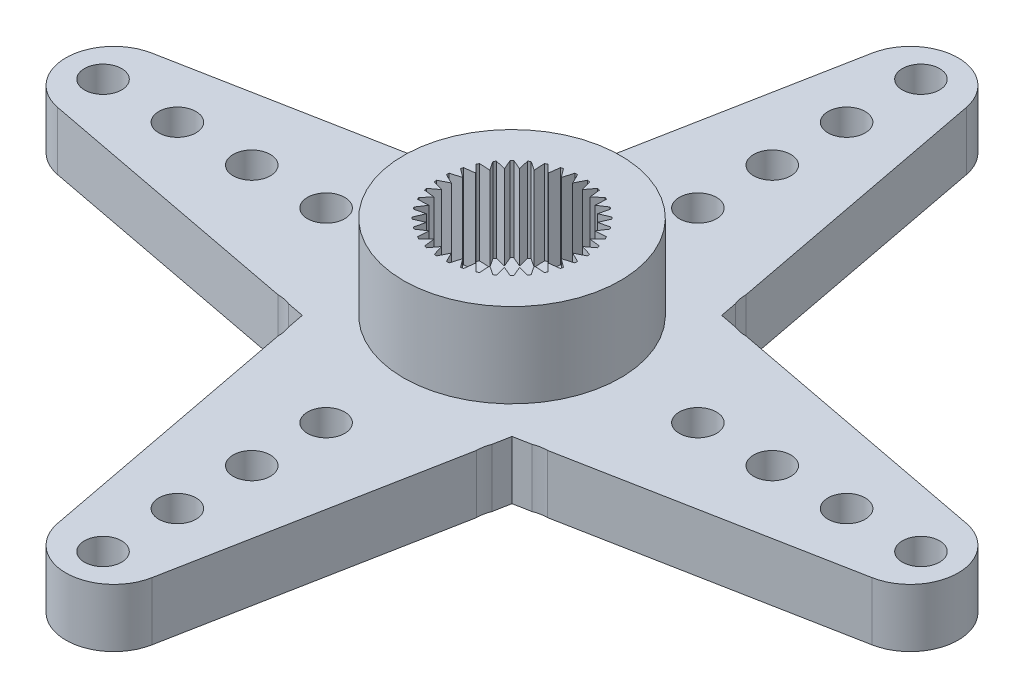
from build123d import *

# Parameters (mm, degrees)
BOSS_EXTRUDE1_DEPTH                                 = 2.35
CUT_EXTRUDE1_DEPTH                                  = 2.35
CUT_EXTRUDE2_DEPTH                                  = 2.35
CUT_EXTRUDE3_DEPTH                                  = 2.35
CUT_EXTRUDE4_DEPTH                                  = 2.35
CUT_EXTRUDE5_DEPTH                                  = 2.35
CUT_EXTRUDE6_DEPTH                                  = 2.35
CUT_EXTRUDE7_DEPTH                                  = 2.35
CUT_EXTRUDE8_DEPTH                                  = 2.35
SKETCH10_R                                          = 4.375
BOSS_EXTRUDE2_DEPTH                                 = 3.4
CUT_EXTRUDE9_DEPTH                                  = 3.4
HOLE1_D                                             = 8.8
HOLE1_DEPTH                                         = 0.3
SKETCH14_W                                          = 3.25
SKETCH14_H                                          = 0.3
F_00_CLEARANCE_HOLE1_D                              = 1.5
CBORE_FOR_3_BINDING_HEAD_MACHINE_SCREW1_D           = 3
CBORE_FOR_3_BINDING_HEAD_MACHINE_SCREW1_DEPTH       = 5.75
CBORE_FOR_3_BINDING_HEAD_MACHINE_SCREW1_CBORE_D     = 5.5
CBORE_FOR_3_BINDING_HEAD_MACHINE_SCREW1_CBORE_DEPTH = 0.3


with BuildPart() as part:
    # Sketch1 → Boss-Extrude1 (new body)
    with BuildSketch(Plane(origin=(0, 2.35, 0), x_dir=(1, 0, 0), z_dir=(0, 1, 0))):
        with BuildLine():
            Line((-16.428641042, -1.9), (-4.230530925, -4.230530925))
            Line((-4.230530925, -4.230530925), (-1.9, -16.428641042))
            ThreePointArc((-1.9, -16.428641042), (0, -18), (1.9, -16.428641042))
            Line((1.9, -16.428641042), (4.230530925, -4.230530925))
            Line((4.230530925, -4.230530925), (16.428641042, -1.9))
            ThreePointArc((16.428641042, -1.9), (18, 0), (16.428641042, 1.9))
            Line((16.428641042, 1.9), (4.230530925, 4.230530925))
            Line((4.230530925, 4.230530925), (1.9, 16.428641042))
            ThreePointArc((1.9, 16.428641042), (0, 18), (-1.9, 16.428641042))
            Line((-1.9, 16.428641042), (-4.230530925, 4.230530925))
            Line((-4.230530925, 4.230530925), (-16.428641042, 1.9))
            ThreePointArc((-16.428641042, 1.9), (-18, 0), (-16.428641042, -1.9))
        make_face()
    extrude(amount=-BOSS_EXTRUDE1_DEPTH)

    # Sketch2 → Cut-Extrude1 (cut)
    with BuildSketch(Plane.XZ):
        with BuildLine():
            Line((4.101224008, 4.907329504), (4, 5.437140793))
            ThreePointArc((4, 5.437140793), (4.025532815, 5.167443601), (4.101224008, 4.907329504))
        make_face()
    extrude(amount=-CUT_EXTRUDE1_DEPTH, mode=Mode.SUBTRACT)

    # Sketch3 → Cut-Extrude2 (cut)
    with BuildSketch(Plane.XZ):
        with BuildLine():
            Line((5.437140793, 4), (4.907329504, 4.101224008))
            ThreePointArc((4.907329504, 4.101224008), (5.167443601, 4.025532815), (5.437140793, 4))
        make_face()
    extrude(amount=-CUT_EXTRUDE2_DEPTH, mode=Mode.SUBTRACT)

    # Sketch4 → Cut-Extrude3 (cut)
    with BuildSketch(Plane.XZ):
        with BuildLine():
            Line((4.907329504, -4.101224008), (5.437140793, -4))
            ThreePointArc((5.437140793, -4), (5.167443601, -4.025532815), (4.907329504, -4.101224008))
        make_face()
    extrude(amount=-CUT_EXTRUDE3_DEPTH, mode=Mode.SUBTRACT)

    # Sketch5 → Cut-Extrude4 (cut)
    with BuildSketch(Plane.XZ):
        with BuildLine():
            Line((4, -5.437140793), (4.101224008, -4.907329504))
            ThreePointArc((4.101224008, -4.907329504), (4.025532815, -5.167443601), (4, -5.437140793))
        make_face()
    extrude(amount=-CUT_EXTRUDE4_DEPTH, mode=Mode.SUBTRACT)

    # Sketch6 → Cut-Extrude5 (cut)
    with BuildSketch(Plane.XZ):
        with BuildLine():
            Line((-4.101224008, -4.907329504), (-4, -5.437140793))
            ThreePointArc((-4, -5.437140793), (-4.025532815, -5.167443601), (-4.101224008, -4.907329504))
        make_face()
    extrude(amount=-CUT_EXTRUDE5_DEPTH, mode=Mode.SUBTRACT)

    # Sketch7 → Cut-Extrude6 (cut)
    with BuildSketch(Plane.XZ):
        with BuildLine():
            Line((-5.437140793, -4), (-4.907329504, -4.101224008))
            ThreePointArc((-4.907329504, -4.101224008), (-5.167443601, -4.025532815), (-5.437140793, -4))
        make_face()
    extrude(amount=-CUT_EXTRUDE6_DEPTH, mode=Mode.SUBTRACT)

    # Sketch8 → Cut-Extrude7 (cut)
    with BuildSketch(Plane.XZ):
        with BuildLine():
            Line((-4.907329504, 4.101224008), (-5.437140793, 4))
            ThreePointArc((-5.437140793, 4), (-5.167443601, 4.025532815), (-4.907329504, 4.101224008))
        make_face()
    extrude(amount=-CUT_EXTRUDE7_DEPTH, mode=Mode.SUBTRACT)

    # Sketch9 → Cut-Extrude8 (cut)
    with BuildSketch(Plane.XZ):
        with BuildLine():
            Line((-4, 5.437140793), (-4.101224008, 4.907329504))
            ThreePointArc((-4.101224008, 4.907329504), (-4.025532815, 5.167443601), (-4, 5.437140793))
        make_face()
    extrude(amount=-CUT_EXTRUDE8_DEPTH, mode=Mode.SUBTRACT)

    # Sketch10 → Boss-Extrude2 (add)
    with BuildSketch(Plane(origin=(0, 2.35, 0), x_dir=(-1, 0, 0), z_dir=(0, 1, 0))):
        with Locations(Location((0, 0, 0), (0, 0, 90))):
            Circle(SKETCH10_R)
    extrude(amount=BOSS_EXTRUDE2_DEPTH)

    # Sketch11 → Cut-Extrude9 (cut)
    with BuildSketch(Plane(origin=(0, 5.75, 0), x_dir=(-1, 0, 0), z_dir=(0, 1, 0))):
        with BuildLine():
            Line((0.687336745, 2.765875666), (0.425438035, 2.412778995))
            Line((0.425438035, 2.412778995), (0.300099924, 2.834155965))
            ThreePointArc((0.300099924, 2.834155965), (0.248393867, 2.83915489), (0.196605286, 2.843210573))
            Line((0.196605286, 2.843210573), (0, 2.45))
            Line((0, 2.45), (-0.196605286, 2.843210573))
            ThreePointArc((-0.196605286, 2.843210573), (-0.248393867, 2.83915489), (-0.300099924, 2.834155965))
            Line((-0.300099924, 2.834155965), (-0.425438035, 2.412778995))
            Line((-0.425438035, 2.412778995), (-0.687336745, 2.765875666))
            ThreePointArc((-0.687336745, 2.765875666), (-0.737634279, 2.752888605), (-0.787686751, 2.738986963))
            Line((-0.787686751, 2.738986963), (-0.837949351, 2.302246921))
            Line((-0.837949351, 2.302246921), (-1.157183824, 2.604501026))
            ThreePointArc((-1.157183824, 2.604501026), (-1.204462046, 2.582977193), (-1.251340114, 2.560595228))
            Line((-1.251340114, 2.560595228), (-1.225, 2.121762239))
            Line((-1.225, 2.121762239), (-1.591870459, 2.363989941))
            ThreePointArc((-1.591870459, 2.363989941), (-1.634692844, 2.334583326), (-1.676972141, 2.304401102))
            Line((-1.676972141, 2.304401102), (-1.574829644, 1.876808886))
            Line((-1.574829644, 1.876808886), (-1.978188915, 2.051650218))
            ThreePointArc((-1.978188915, 2.051650218), (-2.015254326, 2.015254326), (-2.051650218, 1.978188915))
            Line((-2.051650218, 1.978188915), (-1.876808886, 1.574829644))
            Line((-1.876808886, 1.574829644), (-2.304401102, 1.676972141))
            ThreePointArc((-2.304401102, 1.676972141), (-2.334583326, 1.634692844), (-2.363989941, 1.591870459))
            Line((-2.363989941, 1.591870459), (-2.121762239, 1.225))
            Line((-2.121762239, 1.225), (-2.560595228, 1.251340114))
            ThreePointArc((-2.560595228, 1.251340114), (-2.582977193, 1.204462046), (-2.604501026, 1.157183824))
            Line((-2.604501026, 1.157183824), (-2.302246921, 0.837949351))
            Line((-2.302246921, 0.837949351), (-2.738986963, 0.787686751))
            ThreePointArc((-2.738986963, 0.787686751), (-2.752888605, 0.737634279), (-2.765875666, 0.687336745))
            Line((-2.765875666, 0.687336745), (-2.412778995, 0.425438035))
            Line((-2.412778995, 0.425438035), (-2.834155965, 0.300099924))
            ThreePointArc((-2.834155965, 0.300099924), (-2.83915489, 0.248393867), (-2.843210573, 0.196605286))
            Line((-2.843210573, 0.196605286), (-2.45, 0))
            Line((-2.45, 0), (-2.843210573, -0.196605286))
            ThreePointArc((-2.843210573, -0.196605286), (-2.83915489, -0.248393867), (-2.834155965, -0.300099924))
            Line((-2.834155965, -0.300099924), (-2.412778995, -0.425438035))
            Line((-2.412778995, -0.425438035), (-2.765875666, -0.687336745))
            ThreePointArc((-2.765875666, -0.687336745), (-2.752888605, -0.737634279), (-2.738986963, -0.787686751))
            Line((-2.738986963, -0.787686751), (-2.302246921, -0.837949351))
            Line((-2.302246921, -0.837949351), (-2.604501026, -1.157183824))
            ThreePointArc((-2.604501026, -1.157183824), (-2.582977193, -1.204462046), (-2.560595228, -1.251340114))
            Line((-2.560595228, -1.251340114), (-2.121762239, -1.225))
            Line((-2.121762239, -1.225), (-2.363989941, -1.591870459))
            ThreePointArc((-2.363989941, -1.591870459), (-2.334583326, -1.634692844), (-2.304401102, -1.676972141))
            Line((-2.304401102, -1.676972141), (-1.876808886, -1.574829644))
            Line((-1.876808886, -1.574829644), (-2.051650218, -1.978188915))
            ThreePointArc((-2.051650218, -1.978188915), (-2.015254326, -2.015254326), (-1.978188915, -2.051650218))
            Line((-1.978188915, -2.051650218), (-1.574829644, -1.876808886))
            Line((-1.574829644, -1.876808886), (-1.676972141, -2.304401102))
            ThreePointArc((-1.676972141, -2.304401102), (-1.634692844, -2.334583326), (-1.591870459, -2.363989941))
            Line((-1.591870459, -2.363989941), (-1.225, -2.121762239))
            Line((-1.225, -2.121762239), (-1.251340114, -2.560595228))
            ThreePointArc((-1.251340114, -2.560595228), (-1.204462046, -2.582977193), (-1.157183824, -2.604501026))
            Line((-1.157183824, -2.604501026), (-0.837949351, -2.302246921))
            Line((-0.837949351, -2.302246921), (-0.787686751, -2.738986963))
            ThreePointArc((-0.787686751, -2.738986963), (-0.737634279, -2.752888605), (-0.687336745, -2.765875666))
            Line((-0.687336745, -2.765875666), (-0.425438035, -2.412778995))
            Line((-0.425438035, -2.412778995), (-0.300099924, -2.834155965))
            ThreePointArc((-0.300099924, -2.834155965), (-0.248393867, -2.83915489), (-0.196605286, -2.843210573))
            Line((-0.196605286, -2.843210573), (0, -2.45))
            Line((0, -2.45), (0.196605286, -2.843210573))
            ThreePointArc((0.196605286, -2.843210573), (0.248393867, -2.83915489), (0.300099924, -2.834155965))
            Line((0.300099924, -2.834155965), (0.425438035, -2.412778995))
            Line((0.425438035, -2.412778995), (0.687336745, -2.765875666))
            ThreePointArc((0.687336745, -2.765875666), (0.737634279, -2.752888605), (0.787686751, -2.738986963))
            Line((0.787686751, -2.738986963), (0.837949351, -2.302246921))
            Line((0.837949351, -2.302246921), (1.157183824, -2.604501026))
            ThreePointArc((1.157183824, -2.604501026), (1.204462046, -2.582977193), (1.251340114, -2.560595228))
            Line((1.251340114, -2.560595228), (1.225, -2.121762239))
            Line((1.225, -2.121762239), (1.591870459, -2.363989941))
            ThreePointArc((1.591870459, -2.363989941), (1.634692844, -2.334583326), (1.676972141, -2.304401102))
            Line((1.676972141, -2.304401102), (1.574829644, -1.876808886))
            Line((1.574829644, -1.876808886), (1.978188915, -2.051650218))
            ThreePointArc((1.978188915, -2.051650218), (2.015254326, -2.015254326), (2.051650218, -1.978188915))
            Line((2.051650218, -1.978188915), (1.876808886, -1.574829644))
            Line((1.876808886, -1.574829644), (2.304401102, -1.676972141))
            ThreePointArc((2.304401102, -1.676972141), (2.334583326, -1.634692844), (2.363989941, -1.591870459))
            Line((2.363989941, -1.591870459), (2.121762239, -1.225))
            Line((2.121762239, -1.225), (2.560595228, -1.251340114))
            ThreePointArc((2.560595228, -1.251340114), (2.582977193, -1.204462046), (2.604501026, -1.157183824))
            Line((2.604501026, -1.157183824), (2.302246921, -0.837949351))
            Line((2.302246921, -0.837949351), (2.738986963, -0.787686751))
            ThreePointArc((2.738986963, -0.787686751), (2.752888605, -0.737634279), (2.765875666, -0.687336745))
            Line((2.765875666, -0.687336745), (2.412778995, -0.425438035))
            Line((2.412778995, -0.425438035), (2.834155965, -0.300099924))
            ThreePointArc((2.834155965, -0.300099924), (2.83915489, -0.248393867), (2.843210573, -0.196605286))
            Line((2.843210573, -0.196605286), (2.45, 0))
            Line((2.45, 0), (2.843210573, 0.196605286))
            ThreePointArc((2.843210573, 0.196605286), (2.83915489, 0.248393867), (2.834155965, 0.300099924))
            Line((2.834155965, 0.300099924), (2.412778995, 0.425438035))
            Line((2.412778995, 0.425438035), (2.765875666, 0.687336745))
            ThreePointArc((2.765875666, 0.687336745), (2.752888605, 0.737634279), (2.738986963, 0.787686751))
            Line((2.738986963, 0.787686751), (2.302246921, 0.837949351))
            Line((2.302246921, 0.837949351), (2.604501026, 1.157183824))
            ThreePointArc((2.604501026, 1.157183824), (2.582977193, 1.204462046), (2.560595228, 1.251340114))
            Line((2.560595228, 1.251340114), (2.121762239, 1.225))
            Line((2.121762239, 1.225), (2.363989941, 1.591870459))
            ThreePointArc((2.363989941, 1.591870459), (2.334583326, 1.634692844), (2.304401102, 1.676972141))
            Line((2.304401102, 1.676972141), (1.876808886, 1.574829644))
            Line((1.876808886, 1.574829644), (2.051650218, 1.978188915))
            ThreePointArc((2.051650218, 1.978188915), (2.015254326, 2.015254326), (1.978188915, 2.051650218))
            Line((1.978188915, 2.051650218), (1.574829644, 1.876808886))
            Line((1.574829644, 1.876808886), (1.676972141, 2.304401102))
            ThreePointArc((1.676972141, 2.304401102), (1.634692844, 2.334583326), (1.591870459, 2.363989941))
            Line((1.591870459, 2.363989941), (1.225, 2.121762239))
            Line((1.225, 2.121762239), (1.251340114, 2.560595228))
            ThreePointArc((1.251340114, 2.560595228), (1.204462046, 2.582977193), (1.157183824, 2.604501026))
            Line((1.157183824, 2.604501026), (0.837949351, 2.302246921))
            Line((0.837949351, 2.302246921), (0.787686751, 2.738986963))
            ThreePointArc((0.787686751, 2.738986963), (0.737634279, 2.752888605), (0.687336745, 2.765875666))
        make_face()
    extrude(amount=-CUT_EXTRUDE9_DEPTH, mode=Mode.SUBTRACT)

    # Hole1
    with Locations(Plane(origin=(0, 0, 0), x_dir=(-1, 0, 0), z_dir=(0, -1, 0))):
        with Locations((0, 0)):
            Hole(HOLE1_D / 2, depth=HOLE1_DEPTH)

    # Sketch14 → Revolve1 (revolve)
    with BuildSketch(Plane.XY, mode=Mode.PRIVATE) as revolve1_sk:
        with Locations((1.625, 0.15)):
            Rectangle(SKETCH14_W, SKETCH14_H)
    revolve(revolve1_sk.sketch.rotate(Axis((0, 0.3, 0), (0, -1, 0)), 270), axis=Axis((0, 0.3, 0), (0, -1, 0)))

    # #00 Clearance Hole1 (through all)
    with Locations(Plane(origin=(0, 2.35, 0), x_dir=(1, 0, 0), z_dir=(0, 1, 0))):
        with Locations((0, -7.5), (0, -10.5), (0, -13.5), (0, -16.5), (7.5, 0), (10.5, 0), (13.5, 0), (16.5, 0), (0, 7.5), (0, 10.5), (0, 13.5), (0, 16.5), (-7.5, 0), (-10.5, 0), (-13.5, 0), (-16.5, 0)):
            Hole(F_00_CLEARANCE_HOLE1_D / 2)

    # CBORE for #3 Binding Head Machine Screw1
    with Locations(Plane(origin=(0, 0, 0), x_dir=(-1, 0, 0), z_dir=(0, -1, 0))):
        with Locations((0, 0)):
            CounterBoreHole(CBORE_FOR_3_BINDING_HEAD_MACHINE_SCREW1_D / 2, CBORE_FOR_3_BINDING_HEAD_MACHINE_SCREW1_CBORE_D / 2, CBORE_FOR_3_BINDING_HEAD_MACHINE_SCREW1_CBORE_DEPTH, depth=CBORE_FOR_3_BINDING_HEAD_MACHINE_SCREW1_DEPTH)


solid = part.part
